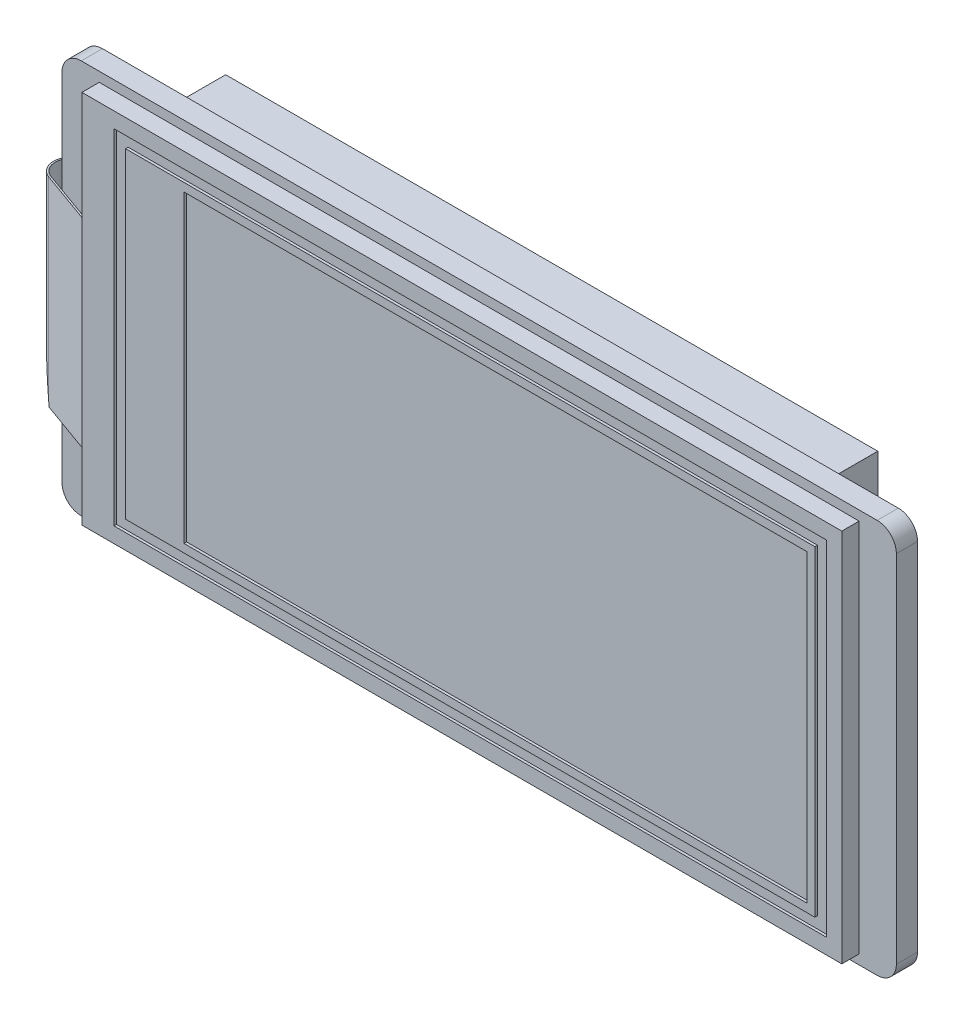
from build123d import *

# Parameters (mm, degrees)
SKIZZE1_W                            = 65
SKIZZE1_H                            = 30.7
AUFSATZ_LINEAR_AUSTRAGEN1_DEPTH      = 1.65
VERRUNDUNG1_R                        = 1.5
SKIZZE5_W                            = 59.2
SKIZZE5_H                            = 29.2
AUFSATZ_LINEAR_AUSTRAGEN2_DEPTH      = 1.35
AUFSATZ_LINEAR_AUSTRAGEN4_DEPTH      = 6.16
AUFSATZ_LINEAR_AUSTRAGEN4_DEPTH_BACK = 9.35
SKIZZE8_W                            = 7.288565097
SKIZZE8_H                            = 6.089435626
SCHNITT_LINEAR_AUSTRAGEN2_DEPTH      = 1
SCHNITT_LINEAR_AUSTRAGEN4_DEPTH      = 38.97199626
SKIZZE10_W                           = 20
SKIZZE10_H                           = 7.5
AUFSATZ_LINEAR_AUSTRAGEN5_DEPTH      = 5.5
SKIZZE11_W                           = 50.8
SKIZZE11_H                           = 5.08
AUFSATZ_LINEAR_AUSTRAGEN6_DEPTH      = 4
SKIZZE12_W                           = 4
SKIZZE12_H                           = 17.2
AUFSATZ_LINEAR_AUSTRAGEN8_DEPTH      = 2
SKIZZE6_W                            = 55.5
SKIZZE6_H                            = 26.8
SKIZZE6_W_2                          = 53.7
SKIZZE6_H_2                          = 25
SKIZZE6_W_3                          = 48.55
SKIZZE6_H_3                          = 23.71
SCHNITT_LINEAR_AUSTRAGEN5_DEPTH      = 0.2
SKIZZE14_W                           = 0.7
SKIZZE14_H                           = 0.7
SCHNITT_LINEAR_AUSTRAGEN6_DEPTH      = 4
LINEARES_MUSTER1_COUNT               = 20
LINEARES_MUSTER1_PITCH               = 2.54


with BuildPart() as part:
    # Skizze1 → Aufsatz-Linear austragen1 (new body)
    with BuildSketch(Plane.XY):
        Rectangle(SKIZZE1_W, SKIZZE1_H)
    extrude(amount=AUFSATZ_LINEAR_AUSTRAGEN1_DEPTH)

    # Verrundung1
    verrundung1_edges = [part.edges().sort_by_distance(p)[0] for p in [
        (32.5, -15.35, 0.825),
        (-32.5, -15.35, 0.825),
        (-32.5, 15.35, 0.825),
        (32.5, 15.35, 0.825),
    ]]
    fillet(verrundung1_edges, radius=VERRUNDUNG1_R)

    # Skizze5 → Aufsatz-Linear austragen2 (add)
    with BuildSketch(Plane.XY.offset(1.65)):
        Rectangle(SKIZZE5_W, SKIZZE5_H)
    extrude(amount=AUFSATZ_LINEAR_AUSTRAGEN2_DEPTH)

    # Skizze7 → Aufsatz-Linear austragen4 (add, two sides: drawn at the far end of the back side and taken through both)
    with BuildSketch(Plane(origin=(0, 0, 0), x_dir=(1, 0, 0), z_dir=(0, 1, 0)).offset(-AUFSATZ_LINEAR_AUSTRAGEN4_DEPTH_BACK)):
        with BuildLine():
            Line((-29.6, -3), (-33.62820322, -1.555086558))
            ThreePointArc((-33.62820322, -1.555086558), (-34.480533405, -0.090657028), (-33.183811445, 1))
            Line((-33.183811445, 1), (-29.5, 1))
            Line((-29.5, 1), (-29.5, 0))
            Line((-29.5, 0), (-29.63, 0))
            Line((-29.63, 0), (-29.63, 0.87))
            Line((-29.63, 0.87), (-33.183811445, 0.87))
            ThreePointArc((-33.183811445, 0.87), (-34.352456122, -0.112932786), (-33.584310626, -1.432720549))
            Line((-33.584310626, -1.432720549), (-29.6, -2.861889751))
            Line((-29.6, -2.861889751), (-29.6, -3))
        make_face()
    extrude(amount=AUFSATZ_LINEAR_AUSTRAGEN4_DEPTH + AUFSATZ_LINEAR_AUSTRAGEN4_DEPTH_BACK)

    # Skizze8 → Schnitt-Linear austragen2 (cut)
    with BuildSketch(Plane(origin=(0, 0, -1), x_dir=(-1, 0, 0), z_dir=(0, 0, -1))):
        with Locations((32.108440886, -9.384717813)):
            Rectangle(SKIZZE8_W, SKIZZE8_H)
    extrude(amount=-SCHNITT_LINEAR_AUSTRAGEN2_DEPTH, mode=Mode.SUBTRACT)

    # Skizze9 → Schnitt-Linear austragen4 (cut, through all)
    with BuildSketch(Plane(origin=(0, 0, -1), x_dir=(-1, 0, 0), z_dir=(0, 0, -1))):
        Polygon((33.987684613, -6.34), (34.5, -6.34), (34.5, -9.35), (33.584310626, -9.35), align=None)
    extrude(amount=-SCHNITT_LINEAR_AUSTRAGEN4_DEPTH, mode=Mode.SUBTRACT)

    # Skizze10 → Aufsatz-Linear austragen5 (add)
    with BuildSketch(Plane(origin=(0, 0, 0), x_dir=(-1, 0, 0), z_dir=(0, 0, -1))):
        with Locations((0, -11.6)):
            Rectangle(SKIZZE10_W, SKIZZE10_H)
    extrude(amount=AUFSATZ_LINEAR_AUSTRAGEN5_DEPTH)

    # Skizze11 → Aufsatz-Linear austragen6 (add)
    with BuildSketch(Plane(origin=(0, 0, 0), x_dir=(-1, 0, 0), z_dir=(0, 0, -1))):
        with Locations((0, 11.85)):
            Rectangle(SKIZZE11_W, SKIZZE11_H)
    extrude(amount=AUFSATZ_LINEAR_AUSTRAGEN6_DEPTH)

    # Skizze12 → Aufsatz-Linear austragen8 (add)
    with BuildSketch(Plane(origin=(0, 0, 0), x_dir=(-1, 0, 0), z_dir=(0, 0, -1))):
        with Locations((27.5, 0)):
            Rectangle(SKIZZE12_W, SKIZZE12_H)
    extrude(amount=AUFSATZ_LINEAR_AUSTRAGEN8_DEPTH)

    # Skizze6 → Schnitt-Linear austragen5 (cut)
    # profile 1 of 2: a face of its own
    with BuildSketch(Plane.XY.offset(3)):
        with Locations((0.65, 0)):
            Rectangle(SKIZZE6_W, SKIZZE6_H)
        with Locations((0.65, 0)):
            Rectangle(SKIZZE6_W_2, SKIZZE6_H_2, mode=Mode.SUBTRACT)
    # profile 2 of 2: a face of its own
    with BuildSketch(Plane.XY.offset(3)):
        with Locations((2.625, -0.001)):
            Rectangle(SKIZZE6_W_3, SKIZZE6_H_3)
    extrude(amount=-SCHNITT_LINEAR_AUSTRAGEN5_DEPTH, mode=Mode.SUBTRACT)

    # Skizze14 → Schnitt-Linear austragen6 (cut)
    with BuildSketch(Plane(origin=(0, 0, -4), x_dir=(-1, 0, 0), z_dir=(0, 0, -1))):
        with Locations((-24.13, 13.12)):
            Rectangle(SKIZZE14_W, SKIZZE14_H)
        with Locations((-24.13, 10.58)):
            Rectangle(SKIZZE14_W, SKIZZE14_H)
    schnitt_linear_austragen6 = extrude(amount=-SCHNITT_LINEAR_AUSTRAGEN6_DEPTH, mode=Mode.SUBTRACT)

    # Lineares Muster1: Schnitt-Linear austragen6 ×20
    with Locations(*[(-i * LINEARES_MUSTER1_PITCH, 0, 0) for i in range(1, LINEARES_MUSTER1_COUNT)]):
        add(schnitt_linear_austragen6, mode=Mode.SUBTRACT)


solid = part.part
